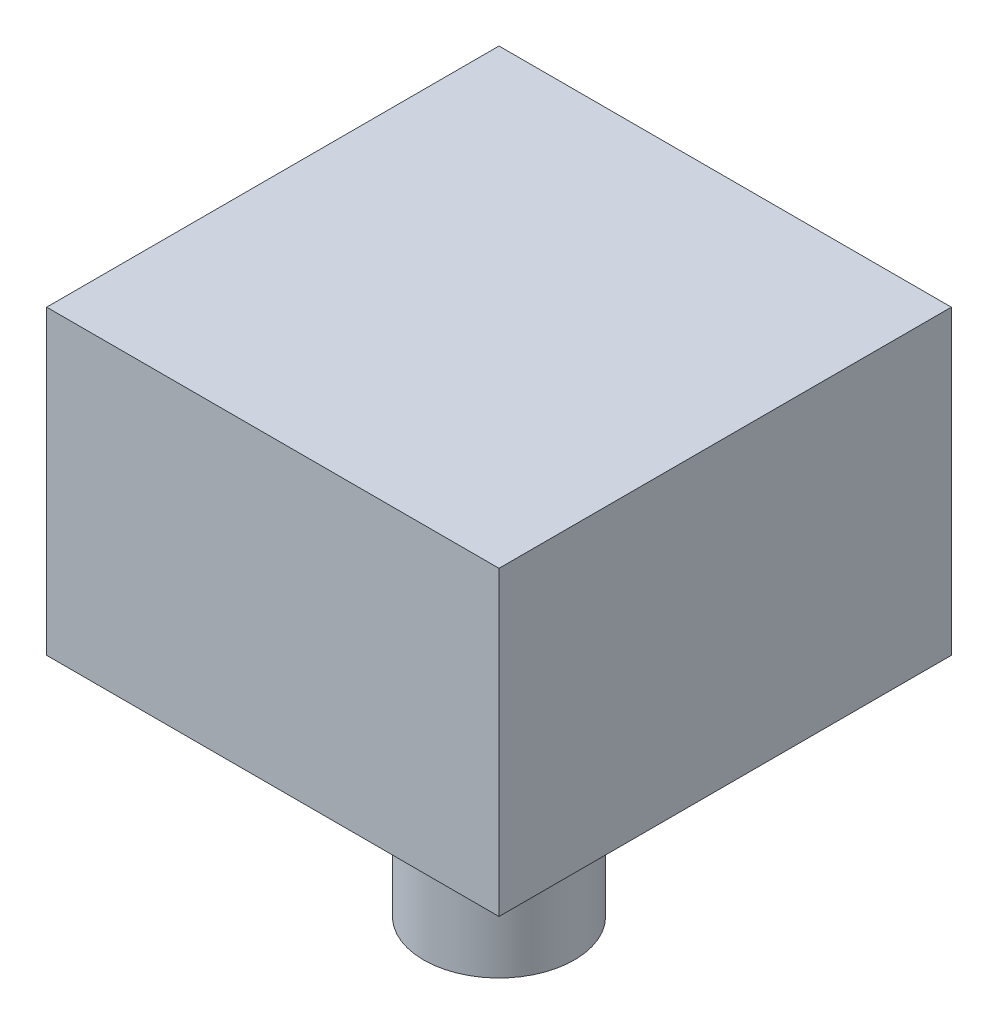
from build123d import *

# Parameters (mm, degrees)
ESQUISSE1_W         = 30
ESQUISSE1_H         = 20
BOSS_EXTRU_1_DEPTH  = 30
SKETCH1_R           = 5
BOSS_EXTRUDE1_DEPTH = 20
SCALE1_SCALE        = 0.6


with BuildPart() as part:
    # Esquisse1 → Boss.-Extru.1 (new body)
    with BuildSketch(Plane.XY):
        with Locations((-15, 10)):
            Rectangle(ESQUISSE1_W, ESQUISSE1_H)
    extrude(amount=BOSS_EXTRU_1_DEPTH)

    # Sketch1 → Boss-Extrude1 (add)
    with BuildSketch(Plane(origin=(0, 0, 0), x_dir=(1, 0, 0), z_dir=(0, 1, 0))):
        with Locations(Location((-20, -10, 0), (0, 0, 270))):
            Circle(SKETCH1_R)
    extrude(amount=-BOSS_EXTRUDE1_DEPTH)


with BuildPart() as part_1:
    # Scale1: scaled about (-15.401311296, 8.394754817, 14.598688704)
    add(part.part.scale(SCALE1_SCALE).moved(Location((-6.160524518, 3.357901927, 5.839475482))))


solid = part_1.part
